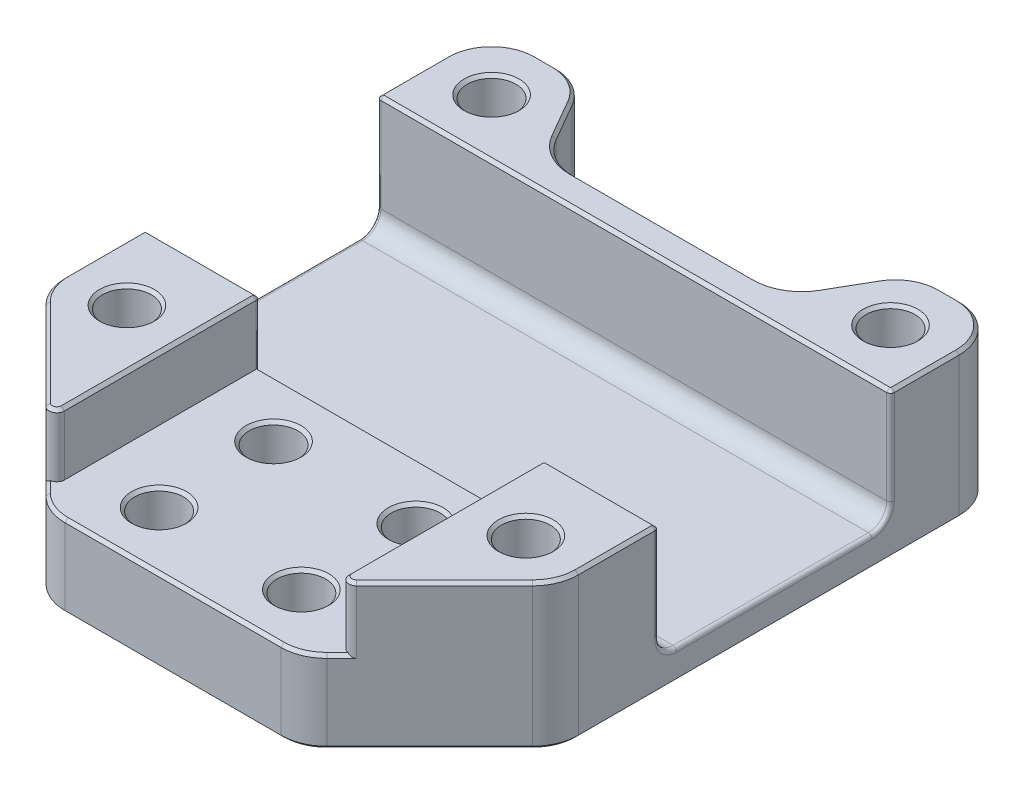
from build123d import *

# Parameters (mm, degrees)
SKETCH1_W           = 16.6624
SKETCH1_H           = 37.2872
BOSS_EXTRUDE1_DEPTH = 100
BOSS_EXTRUDE2_DEPTH = 18.6436
SKETCH2_3_W         = 8.2312
SKETCH2_3_H         = 29.9
SKETCH2_3_H_2       = 0.1
BOSS_EXTRUDE3_DEPTH = 15
SKETCH3_R           = 3.2
CUT_EXTRUDE1_DEPTH  = 151.542823877
FILLET1_R           = 6
FILLET3_R           = 2.4
FILLET2_R           = 0.5
FILLET4_R           = 1
CHAMFER1_SIZE       = 0.4


with BuildPart() as part:
    # Sketch1 → Boss-Extrude1 (new, symmetric)
    with BuildSketch(Plane(origin=(0, 0, 0), x_dir=(0, 1, 0), z_dir=(0, 0, 1))):
        Rectangle(SKETCH1_W, SKETCH1_H)
    extrude(amount=BOSS_EXTRUDE1_DEPTH, both=True)


with BuildPart() as body_2:
    # Sketch2 → Boss-Extrude2 (new body)
    with BuildSketch(Plane.YZ.offset(18.6436)):
        Polygon((-8.3312, -100), (-8.3312, -70.1), (-19.1, -70.1), (-19.1, -145.5), (-0.1, -145.5), (-0.1, -130.5), (-15.2, -130.5), (-15.2, -100.1), (-8.3312, -100.1), align=None)
    extrude(amount=-BOSS_EXTRUDE2_DEPTH)

    # Sketch2<3> → Boss-Extrude3 (add)
    with BuildSketch(Plane.YZ.offset(18.6436)):
        Polygon((-8.3312, -100), (-8.3312, -70.1), (-19.1, -70.1), (-19.1, -145.5), (-0.1, -145.5), (-0.1, -130.5), (-15.2, -130.5), (-15.2, -100.1), (-8.3312, -100.1), align=None)
        with Locations((-4.2156, -85.05)):
            Rectangle(SKETCH2_3_W, SKETCH2_3_H)
        with Locations((-4.2156, -100.05)):
            Rectangle(SKETCH2_3_W, SKETCH2_3_H_2)
    extrude(amount=BOSS_EXTRUDE3_DEPTH)

    # Sketch3 → Cut-Extrude1 (cut, through all)
    with BuildSketch(Plane.XZ.offset(19.1)):
        Polygon((15.46262002, -134.5), (0, -134.5), (0, -145.5), (21.813472981, -145.5), align=None)
        with Locations(Location((26.1436, -138, 0), (0, 0, 270))):
            Circle(SKETCH3_R)
        with Locations(Location((26.1436, -90.206601718, 0), (0, 0, 270))):
            Circle(SKETCH3_R)
        Polygon((33.6436, -70.1), (18.6436, -70.1), (18.6436, -72.1), (33.6436, -87.1), align=None)
        Polygon((18.6436, -70.1), (16.6436, -70.1), (18.6436, -72.1), align=None)
        with Locations(Location((9.3218, -77.6, 0), (0, 0, 270))):
            Circle(SKETCH3_R)
        with Locations(Location((9.3218, -92.6, 0), (0, 0, 270))):
            Circle(SKETCH3_R)
    extrude(amount=-CUT_EXTRUDE1_DEPTH, mode=Mode.SUBTRACT)

    # Fillet1
    fillet1_edges = [body_2.edges().sort_by_distance(p)[0] for p in [
        (15.46262002, -9.6, -134.5),
        (21.813472981, -9.6, -145.5),
        (33.6436, -9.6, -145.5),
        (16.6436, -13.7156, -70.1),
        (33.6436, -9.6, -87.1),
    ]]
    fillet(fillet1_edges, radius=FILLET1_R)

    # Fillet3
    fillet3_edges = [body_2.edges().sort_by_distance(p)[0] for p in [
        (16.8218, -15.2, -130.5),
        (16.8218, -15.2, -100.1),
    ]]
    fillet(fillet3_edges, radius=FILLET3_R)

    # Fillet2
    fillet2_edges = [body_2.edges().sort_by_distance(p)[0] for p in [
        (33.6436, -6.45, -130.5),
        (33.6436, -15.2, -115.3),
        (33.6436, -14.497056275, -129.797056275),
        (33.6436, -14.497056275, -100.802943725),
        (33.6436, -6.45, -100.1),
        (18.6436, -4.2156, -100.1),
    ]]
    fillet(fillet2_edges, radius=FILLET2_R)

    # Fillet4
    fillet4_edges = [body_2.edges().sort_by_distance(p)[0] for p in [
        (18.6436, -4.2156, -72.1),
    ]]
    fillet(fillet4_edges, radius=FILLET4_R)

    # Chamfer1
    chamfer1_edges = [body_2.edges().sort_by_distance(p)[0] for p in [
        (26.1436, -0.1, -87.006601718),
        (26.1436, -19.1, -87.006601718),
        (26.1436, -0.1, -134.8),
        (26.1436, -19.1, -134.8),
        (9.3218, -8.3312, -89.4),
        (9.3218, -19.1, -89.4),
        (5.999259202, -19.1, -134.5),
        (5.999259202, -0.1, -134.5),
        (26.460587298, -0.1, -145.5),
        (26.460587298, -19.1, -145.5),
        (33.6436, -19.1, -114.542640687),
        (25.1436, -19.1, -78.6),
        (18.638046501, -19.1, -140),
        (16.45441922, -19.1, -70.556722805),
        (33.186877195, -19.1, -87.28918078),
        (22.277574596, -19.1, -144.696152423),
        (31.886240687, -19.1, -143.742640687),
        (18.638046501, -0.1, -140),
        (22.277574596, -0.1, -144.696152423),
        (31.886240687, -0.1, -143.742640687),
        (19.375833047, -8.3312, -72.832233047),
        (33.186877195, -0.1, -87.28918078),
        (16.45441922, -8.3312, -70.556722805),
        (14.998518405, -19.1, -135.303847577),
        (14.998518405, -0.1, -135.303847577),
        (33.6436, -0.1, -135.25),
        (33.6436, -0.1, -94.592640687),
        (33.497153391, -0.1, -130.646446609),
        (18.6436, -0.1, -87.057106781),
        (26.1436, -0.1, -100.1),
        (33.497153391, -0.1, -99.953553391),
        (18.790046609, -0.1, -99.953553391),
        (26.118473734, -0.1, -79.574873734),
        (19.260916568, -0.1, -73.59033403),
        (7.079159313, -19.1, -70.1),
        (16.5718, -0.1, -130.5),
        (9.5718, -8.3312, -100.1),
        (7.079159313, -8.3312, -70.1),
        (9.3218, -8.3312, -74.4),
        (9.3218, -19.1, -74.4),
    ]]
    chamfer(chamfer1_edges, length=CHAMFER1_SIZE)

    # Mirror1: body 2 across plane


with BuildPart() as body_2_1:
    add(body_2.part)
    add(body_2.part.mirror(Plane(origin=(0, 0, 0), x_dir=(0, 0, 1), z_dir=(1, 0, 0))))


solid = body_2_1.part
